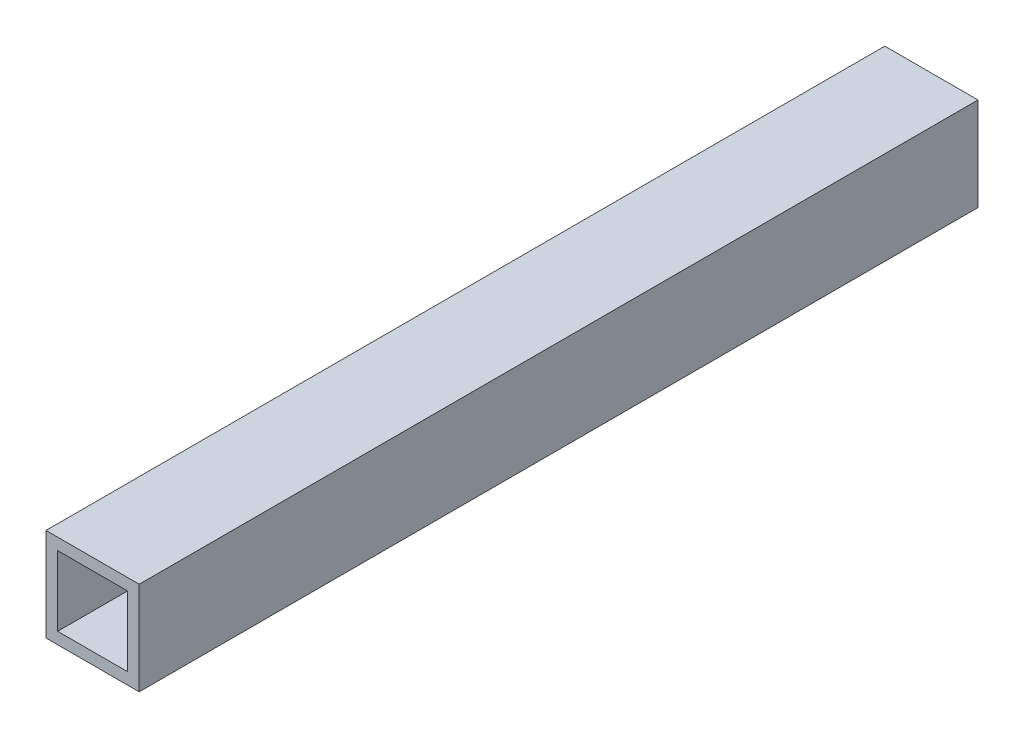
from build123d import *

# Parameters (mm, degrees)
SKETCH1_W           = 25.4
SKETCH1_H           = 25.4
BOSS_EXTRUDE1_DEPTH = 114.3
SHELL1_T            = -3.175


with BuildPart() as part:
    # Sketch1 → Boss-Extrude1 (new, symmetric)
    with BuildSketch(Plane.XY):
        Rectangle(SKETCH1_W, SKETCH1_H)
    extrude(amount=BOSS_EXTRUDE1_DEPTH, both=True)

    # Shell1
    shell1_openings = [part.faces().sort_by_distance(p)[0] for p in [
        (0, 0, 114.3),
        (0, 0, -114.3),
    ]]
    offset(amount=SHELL1_T, openings=shell1_openings, kind=Kind.INTERSECTION)


solid = part.part
